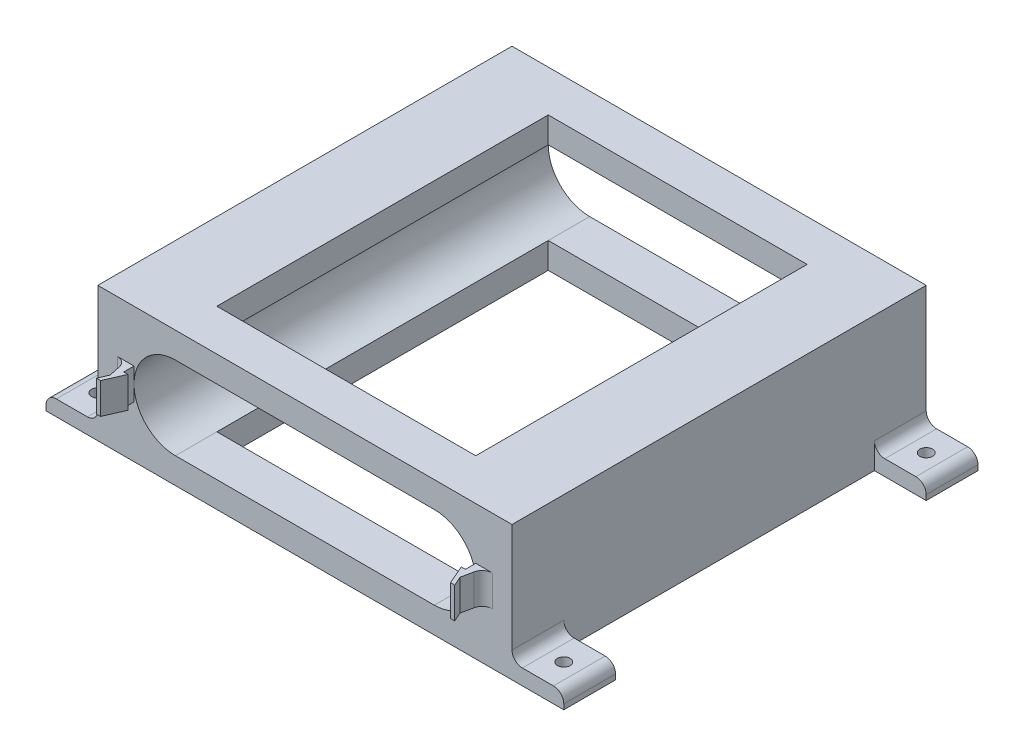
from build123d import *

# Parameters (mm, degrees)
SKETCH1_W            = 101.6
SKETCH1_H            = 33.02
BOSS_EXTRUDE1_DEPTH  = 101.6
SKETCH2_W            = 63.5
SKETCH2_H            = 81.28
CUT_EXTRUDE1_DEPTH   = 119.294211186
BOSS_EXTRUDE2_START  = -16.51
BOSS_EXTRUDE2_DEPTH  = 3.81
FILLET2_R            = 2.54
SKETCH4_W            = 12.7
SKETCH4_H            = 12.7
SKETCH4_R            = 1.55
BOSS_EXTRUDE3_DEPTH  = 3.81
FILLET3_R            = 2.54
FILLET2_OF_MIRROR1_R = 2.54


with BuildPart() as part:
    # Sketch1 → Boss-Extrude1 (new body)
    with BuildSketch(Plane.XY):
        Rectangle(SKETCH1_W, SKETCH1_H)
        with BuildLine():
            Line((-31.75, 10.16), (31.75, 10.16))
            ThreePointArc((31.75, 10.16), (41.91, 0), (31.75, -10.16))
            Line((31.75, -10.16), (-31.75, -10.16))
            ThreePointArc((-31.75, -10.16), (-41.91, 0), (-31.75, 10.16))
        make_face(mode=Mode.SUBTRACT)
    extrude(amount=-BOSS_EXTRUDE1_DEPTH)

    # Sketch2 → Cut-Extrude1 (cut, through all)
    with BuildSketch(Plane(origin=(0, 16.51, 0), x_dir=(1, 0, 0), z_dir=(0, 1, 0))):
        with Locations((0, 50.8)):
            Rectangle(SKETCH2_W, SKETCH2_H)
    extrude(amount=-CUT_EXTRUDE1_DEPTH, mode=Mode.SUBTRACT)

    # Sketch3 → Boss-Extrude2 (add, symmetric)
    with BuildSketch(Plane(origin=(0, 16.51, 0), x_dir=(1, 0, 0), z_dir=(0, 1, 0)).offset(BOSS_EXTRUDE2_START)):
        Polygon((-42.926, -4.867948453), (-43.942, -7.195896906), (-42.926, -7.195896906), (-41.91, -4.867948453), (-40.894, -2.54), (-41.91, -2.54), (-41.91, 0), (-43.942, 0), align=None)
    boss_extrude2 = extrude(amount=BOSS_EXTRUDE2_DEPTH, both=True)

    # Fillet2
    fillet2_edges = [part.edges().sort_by_distance(p)[0] for p in [
        (-43.942, 0, 0),
    ]]
    fillet(fillet2_edges, radius=FILLET2_R)

    # Sketch4 → Boss-Extrude3 (add)
    # profile 1 of 4: a face of its own
    with BuildSketch(Plane.XZ.offset(16.51)):
        with Locations((-57.15, -95.25)):
            Rectangle(SKETCH4_W, SKETCH4_H)
        with Locations((-57.15, -95.25)):
            Circle(SKETCH4_R, mode=Mode.SUBTRACT)
    # profile 2 of 4: a face of its own
    with BuildSketch(Plane.XZ.offset(16.51)):
        with Locations((57.15, -95.25)):
            Rectangle(SKETCH4_W, SKETCH4_H)
        with Locations((57.15, -95.25)):
            Circle(SKETCH4_R, mode=Mode.SUBTRACT)
    # profile 3 of 4: a face of its own
    with BuildSketch(Plane.XZ.offset(16.51)):
        with Locations((57.15, -6.35)):
            Rectangle(SKETCH4_W, SKETCH4_H)
        with Locations((57.15, -6.35)):
            Circle(SKETCH4_R, mode=Mode.SUBTRACT)
    # profile 4 of 4: a face of its own
    with BuildSketch(Plane.XZ.offset(16.51)):
        with Locations((-57.15, -6.35)):
            Rectangle(SKETCH4_W, SKETCH4_H)
        with Locations((-57.15, -6.35)):
            Circle(SKETCH4_R, mode=Mode.SUBTRACT)
    extrude(amount=-BOSS_EXTRUDE3_DEPTH)

    # Fillet3
    fillet3_edges = [part.edges().sort_by_distance(p)[0] for p in [
        (-63.5, -12.7, -95.25),
        (-50.8, -12.7, -95.25),
        (63.5, -12.7, -95.25),
        (50.8, -12.7, -95.25),
        (63.5, -12.7, -6.35),
        (50.8, -12.7, -6.35),
        (-63.5, -12.7, -6.35),
        (-50.8, -12.7, -6.35),
    ]]
    fillet(fillet3_edges, radius=FILLET3_R)

    # Mirror1: Boss-Extrude2 across plane
    add(boss_extrude2.mirror(Plane(origin=(0, 0, 0), x_dir=(0, 0, 1), z_dir=(1, 0, 0))))

    # Fillet2 of Mirror1
    fillet2_of_mirror1_edges = [part.edges().sort_by_distance(p)[0] for p in [
        (43.942, 0, 0),
    ]]
    fillet(fillet2_of_mirror1_edges, radius=FILLET2_OF_MIRROR1_R)


solid = part.part
